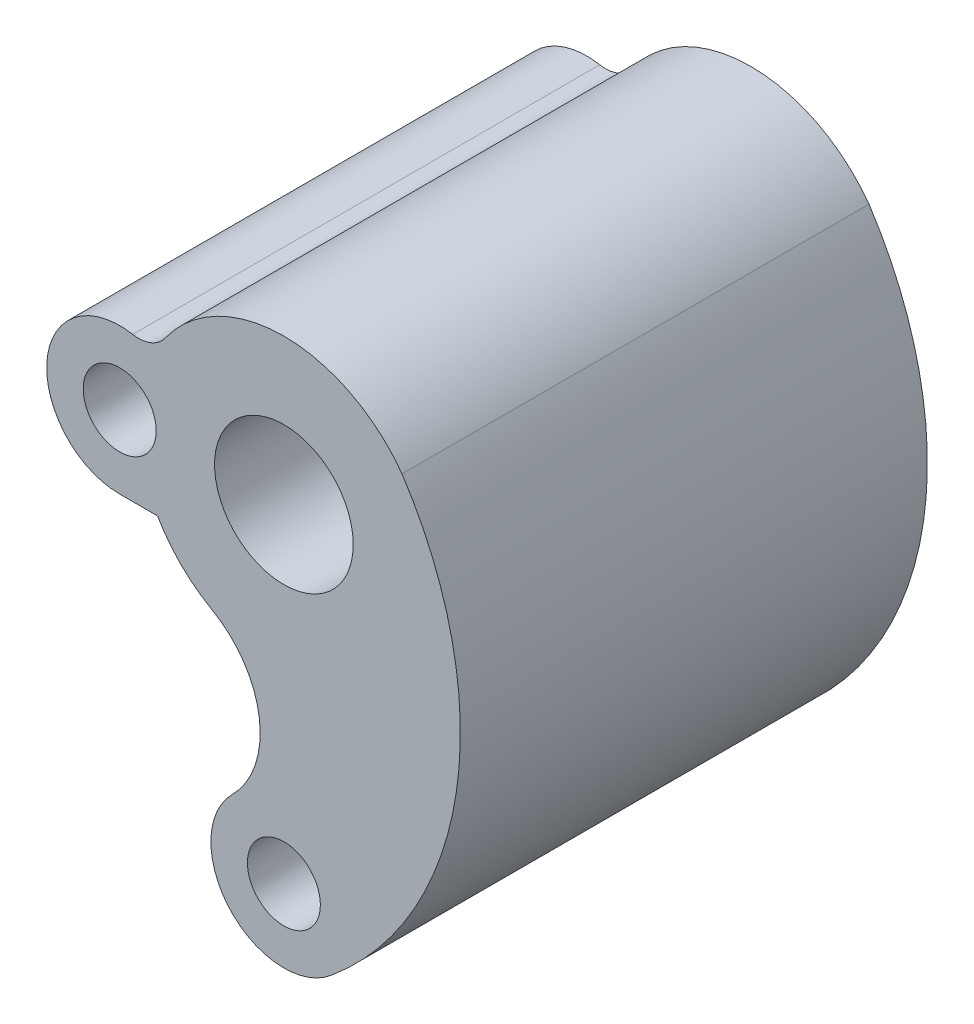
from build123d import *

# Parameters (mm, degrees)
SKETCH1_R           = 10
SKETCH1_R_2         = 19
BOSS_EXTRUDE1_DEPTH = 128


with BuildPart() as part:
    # Sketch1 → Boss-Extrude1 (new body)
    with BuildSketch(Plane.XY):
        with BuildLine():
            ThreePointArc((20.542128414, 23.491399981), (-11.954310602, 39.999816289), (-44.350086912, 23.294726197))
            ThreePointArc((-44.350086912, 23.294726197), (-48.286212782, 20.194921951), (-53.269861719, 19.680027304))
            ThreePointArc((-53.269861719, 19.680027304), (-76.75292632, 1.788778062), (-56.833080109, -20))
            Line((-56.833080109, -20), (-46.474096261, -20))
            ThreePointArc((-46.474096261, -20), (-39.993245797, -28.407834632), (-31.528984999, -34.814814815))
            ThreePointArc((-31.528984999, -34.814814815), (-18.567319972, -53.9492851), (-25.962751008, -75.845410628))
            ThreePointArc((-25.962751008, -75.845410628), (-26.45371097, -103.646873387), (1.315633204, -105.070213608))
            ThreePointArc((1.315633204, -105.070213608), (35.455910615, -44.457444325), (20.542128414, 23.491399981))
        make_face()
        with Locations((-56.833080109, 0)):
            Circle(SKETCH1_R, mode=Mode.SUBTRACT)
        with Locations((-11.833080109, -90)):
            Circle(SKETCH1_R, mode=Mode.SUBTRACT)
        with Locations((-11.833080109, 0)):
            Circle(SKETCH1_R_2, mode=Mode.SUBTRACT)
    extrude(amount=BOSS_EXTRUDE1_DEPTH)


solid = part.part
